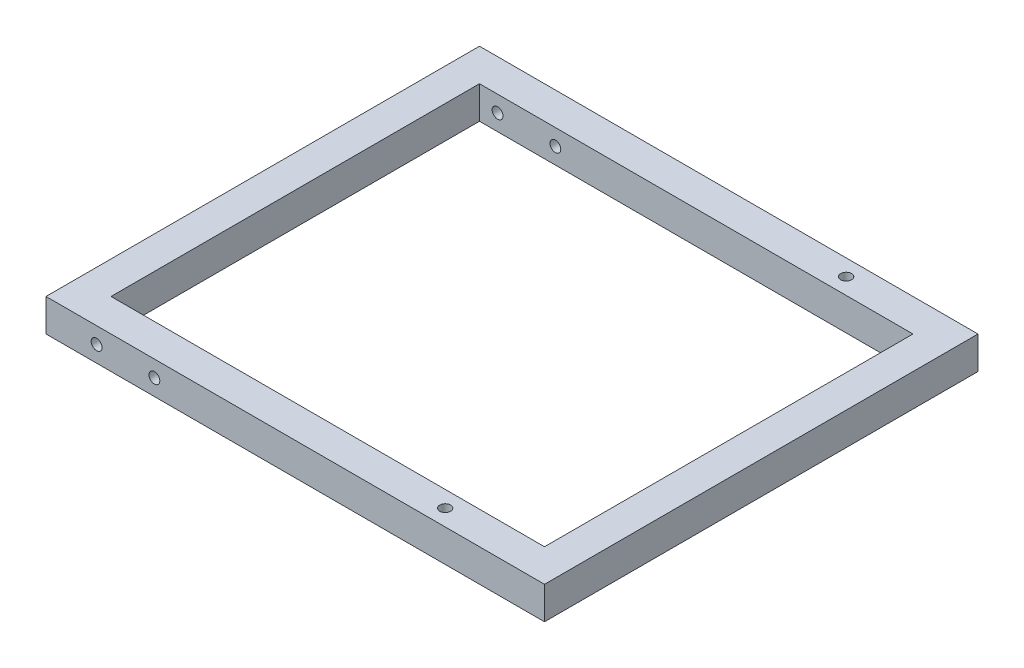
from build123d import *

# Parameters (mm, degrees)
SKETCH1_W           = 438.15
SKETCH1_H           = 381
SKETCH1_W_2         = 381
SKETCH1_H_2         = 323.85
BOSS_EXTRUDE1_DEPTH = 28.575
SKETCH2_R           = 4.7625
CUT_EXTRUDE1_DEPTH  = 582.337211199
SKETCH3_R           = 4.7625
CUT_EXTRUDE2_DEPTH  = 28.575


with BuildPart() as part:
    # Sketch1 → Boss-Extrude1 (new body)
    with BuildSketch(Plane(origin=(0, 0, 0), x_dir=(1, 0, 0), z_dir=(0, 1, 0))):
        with Locations((219.075, -190.5)):
            Rectangle(SKETCH1_W, SKETCH1_H)
        with Locations((219.075, -190.5)):
            Rectangle(SKETCH1_W_2, SKETCH1_H_2, mode=Mode.SUBTRACT)
    extrude(amount=BOSS_EXTRUDE1_DEPTH)

    # Sketch2 → Cut-Extrude1 (cut, through all)
    with BuildSketch(Plane(origin=(0, 0, 0), x_dir=(-1, 0, 0), z_dir=(0, 0, -1))):
        with Locations((-44.45, 14.2875)):
            Circle(SKETCH2_R)
        with Locations((-95.25, 14.2875)):
            Circle(SKETCH2_R)
    extrude(amount=-CUT_EXTRUDE1_DEPTH, mode=Mode.SUBTRACT)

    # Sketch3 → Cut-Extrude2 (cut)
    with BuildSketch(Plane(origin=(0, 28.575, 0), x_dir=(1, 0, 0), z_dir=(0, 1, 0))):
        with Locations(Location((336.55, -14.2875, 0), (0, 0, 270))):
            Circle(SKETCH3_R)
        with Locations(Location((336.55, -366.7125, 0), (0, 0, 90))):
            Circle(SKETCH3_R)
    extrude(amount=-CUT_EXTRUDE2_DEPTH, mode=Mode.SUBTRACT)


solid = part.part
